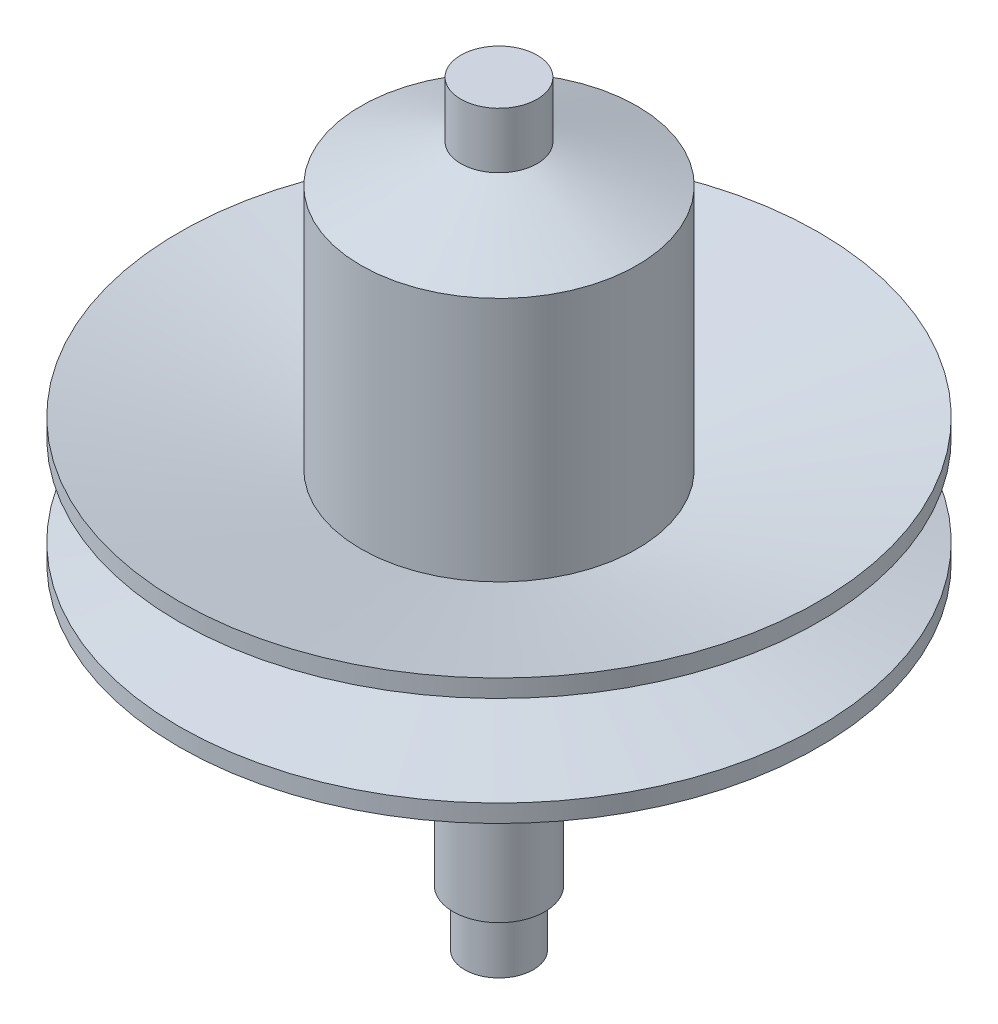
from build123d import *


with BuildPart() as part:
    # Sketch1 → Revolve1 (revolve)
    with BuildSketch(Plane.XY, mode=Mode.PRIVATE) as revolve1_sk:
        Polygon((0, 99.06), (5, 99.06), (5, 91.74), (18.0975, 86.74), (18.0975, 54.561858236), (41.91, 60.498), (41.91, 58.179141764), (18.0975, 52.243), (41.91, 46.306858236), (41.91, 43.988), (18.0975, 49.924141764), (6, 49.924141764), (6, 7.3358), (4.5, 7.3358), (4.5, 0), (0, 0), align=None)
    revolve(revolve1_sk.sketch.rotate(Axis((0, 99.06, 0), (0, -1, 0)), 90), axis=Axis((0, 99.06, 0), (0, -1, 0)))


solid = part.part
